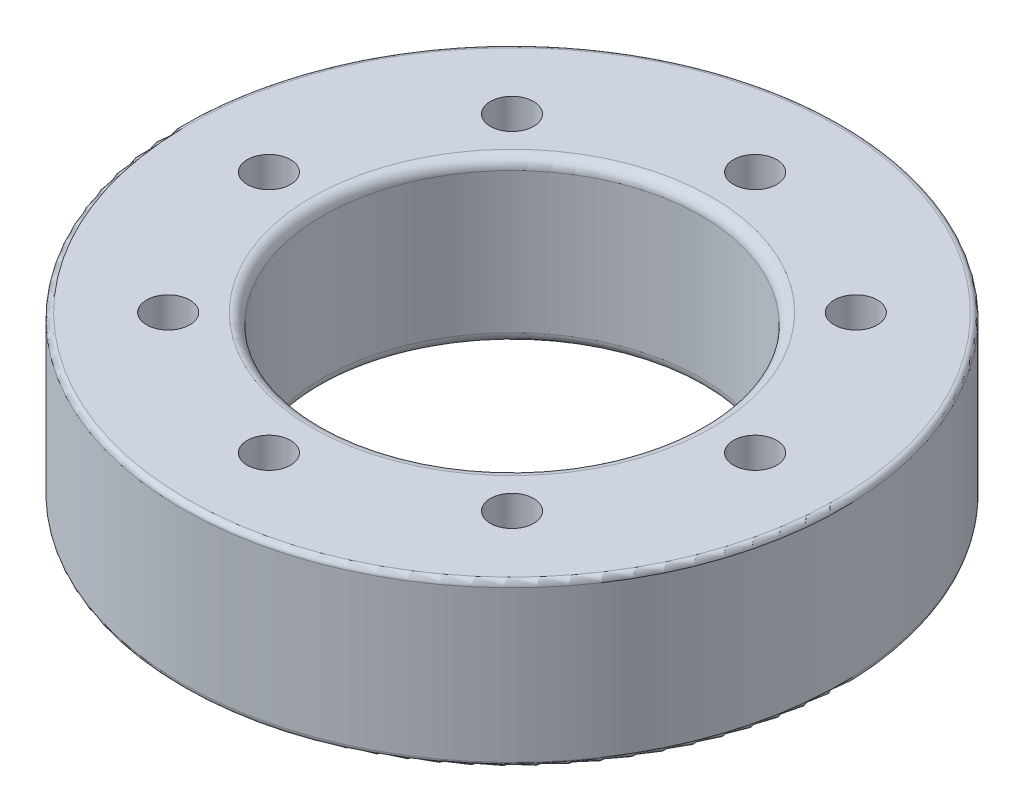
from build123d import *

# Parameters (mm, degrees)
SKETCH1_R           = 30.5
SKETCH1_R_2         = 17.5
BOSS_EXTRUDE1_DEPTH = 15
SKETCH2_R           = 2
CUT_EXTRUDE1_DEPTH  = 15
FILLET1_R           = 1
FILLET2_R           = 0.5


with BuildPart() as part:
    # Sketch1 → Boss-Extrude1 (new body)
    with BuildSketch(Plane(origin=(0, 0, 0), x_dir=(1, 0, 0), z_dir=(0, 1, 0))):
        with Locations(Location((0, 0, 0), (0, 0, 270))):
            Circle(SKETCH1_R)
        with Locations(Location((0, 0, 0), (0, 0, 270))):
            Circle(SKETCH1_R_2, mode=Mode.SUBTRACT)
    extrude(amount=BOSS_EXTRUDE1_DEPTH)

    # Sketch2 → Cut-Extrude1 (cut)
    with BuildSketch(Plane(origin=(0, 15, 0), x_dir=(1, 0, 0), z_dir=(0, 1, 0))):
        with Locations(Location((0, 22.5, 0), (0, 0, 270))):
            Circle(SKETCH2_R)
        with Locations(Location((15.909902577, 15.909902577, 0), (0, 0, 270))):
            Circle(SKETCH2_R)
        with Locations(Location((22.5, 0, 0), (0, 0, 270))):
            Circle(SKETCH2_R)
        with Locations(Location((15.909902577, -15.909902577, 0), (0, 0, 270))):
            Circle(SKETCH2_R)
        with Locations(Location((0, -22.5, 0), (0, 0, 270))):
            Circle(SKETCH2_R)
        with Locations(Location((-15.909902577, -15.909902577, 0), (0, 0, 270))):
            Circle(SKETCH2_R)
        with Locations(Location((-22.5, 0, 0), (0, 0, 270))):
            Circle(SKETCH2_R)
        with Locations(Location((-15.909902577, 15.909902577, 0), (0, 0, 270))):
            Circle(SKETCH2_R)
    extrude(amount=-CUT_EXTRUDE1_DEPTH, mode=Mode.SUBTRACT)

    # Fillet1
    fillet1_edges = [part.edges().sort_by_distance(p)[0] for p in [
        (0, 0, -17.5),
        (0, 15, -17.5),
    ]]
    fillet(fillet1_edges, radius=FILLET1_R)

    # Fillet2
    fillet2_edges = [part.edges().sort_by_distance(p)[0] for p in [
        (0, 0, -30.5),
        (0, 15, -30.5),
    ]]
    fillet(fillet2_edges, radius=FILLET2_R)


solid = part.part
